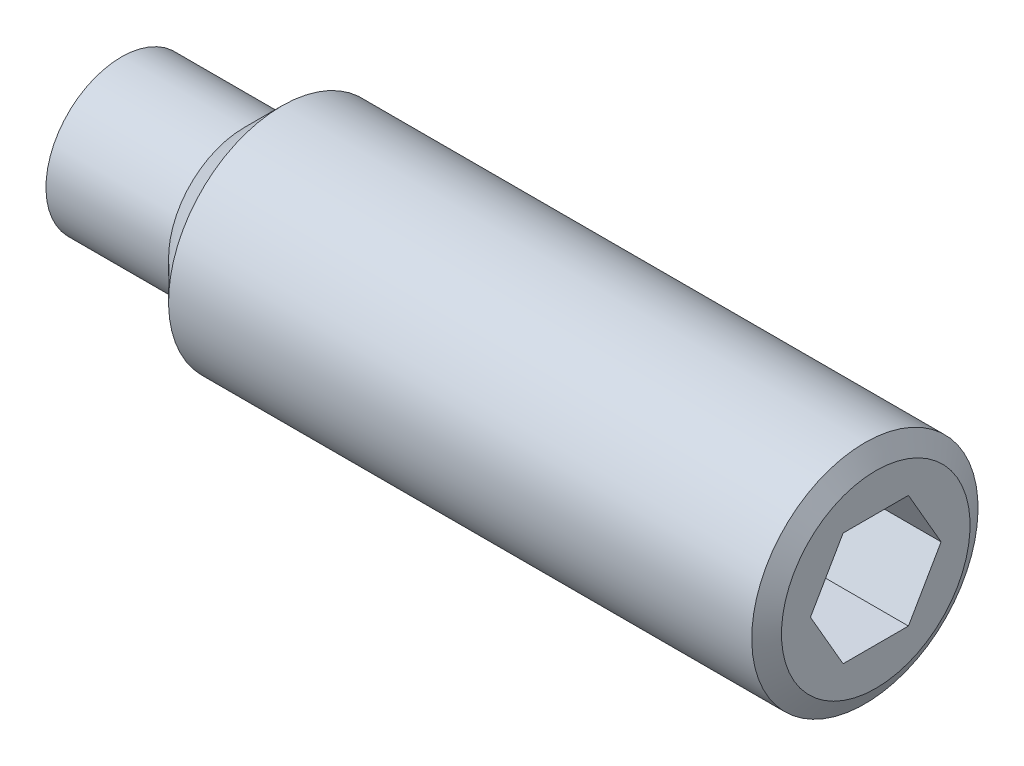
from build123d import *

# Parameters (mm, degrees)
CUT_EXTRUDE1_DEPTH = 3.5
CHAMFER1_SIZE      = 0.5
CHAMFER1_SIZE2     = 0.288675135


with BuildPart() as part:
    # Sketch1 → Revolve1 (revolve)
    with BuildSketch(Plane.XY):
        Polygon((0, 0), (0, 3), (-15.75, 3), (-16.75, 2), (-20, 2), (-20, 0), align=None)
    revolve(axis=Axis((0, 0, 0), (-1, 0, 0)))

    # Sketch2 → Cut-Extrude1 (cut)
    with BuildSketch(Plane(origin=(0, 0, 0), x_dir=(0, 0, -1), z_dir=(1, 0, 0))):
        Polygon((1.732050808, 0), (0.866025404, 1.5), (-0.866025404, 1.5), (-1.732050808, 0), (-0.866025404, -1.5), (0.866025404, -1.5), align=None)
    extrude(amount=-CUT_EXTRUDE1_DEPTH, mode=Mode.SUBTRACT)

    # Chamfer1
    chamfer1_edges = [part.edges().sort_by_distance(p)[0] for p in [
        (0, -3, 0),
    ]]
    chamfer1_side = [part.faces().sort_by_distance(p)[0] for p in [
        (0, -2.915147186, 0),
    ]]
    chamfer(chamfer1_edges, length=CHAMFER1_SIZE, length2=CHAMFER1_SIZE2, reference=chamfer1_side[0])


solid = part.part
